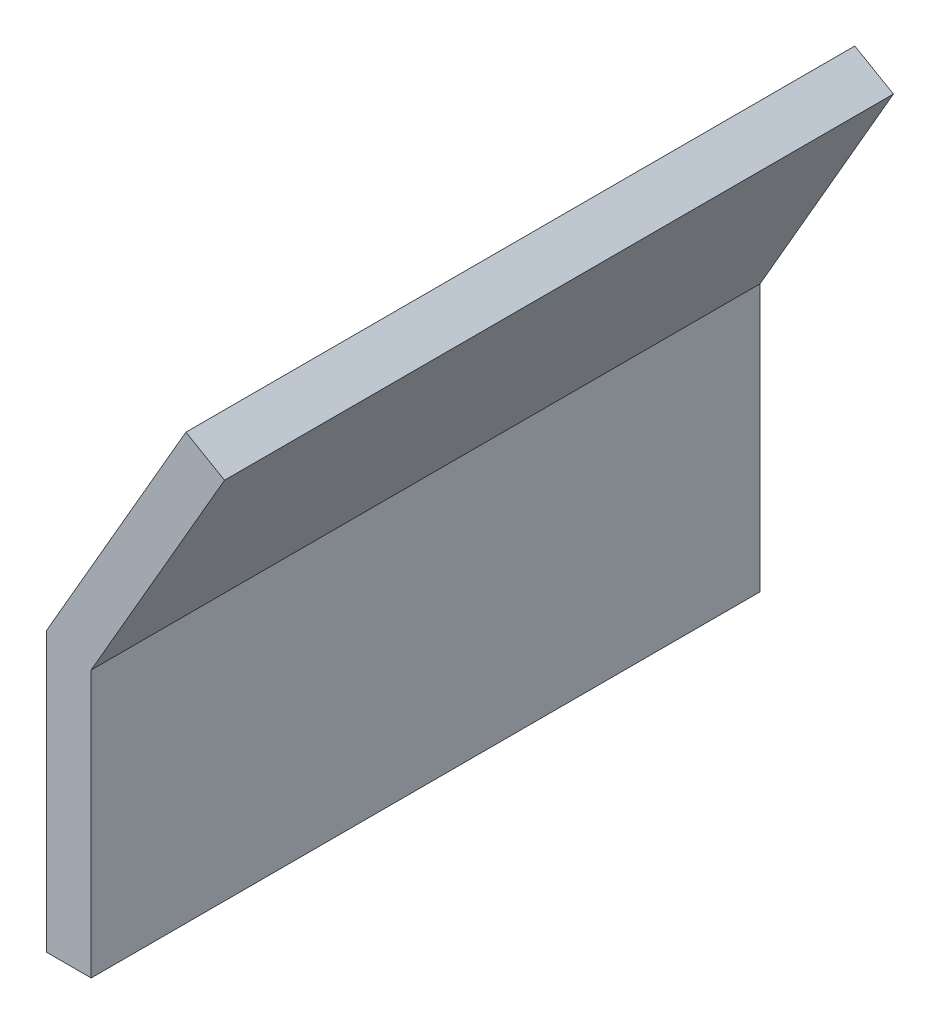
from build123d import *

# Parameters (mm, degrees)
BOSS_EXTRUDE1_DEPTH = 60


with BuildPart() as part:
    # Sketch1 → Boss-Extrude1 (new, symmetric)
    with BuildSketch(Plane.XY):
        Polygon((0, 0), (25, 43.301270189), (31.92820323, 39.301270189), (8, -2.143593539), (8, -50), (0, -50), align=None)
    extrude(amount=BOSS_EXTRUDE1_DEPTH, both=True)


solid = part.part
